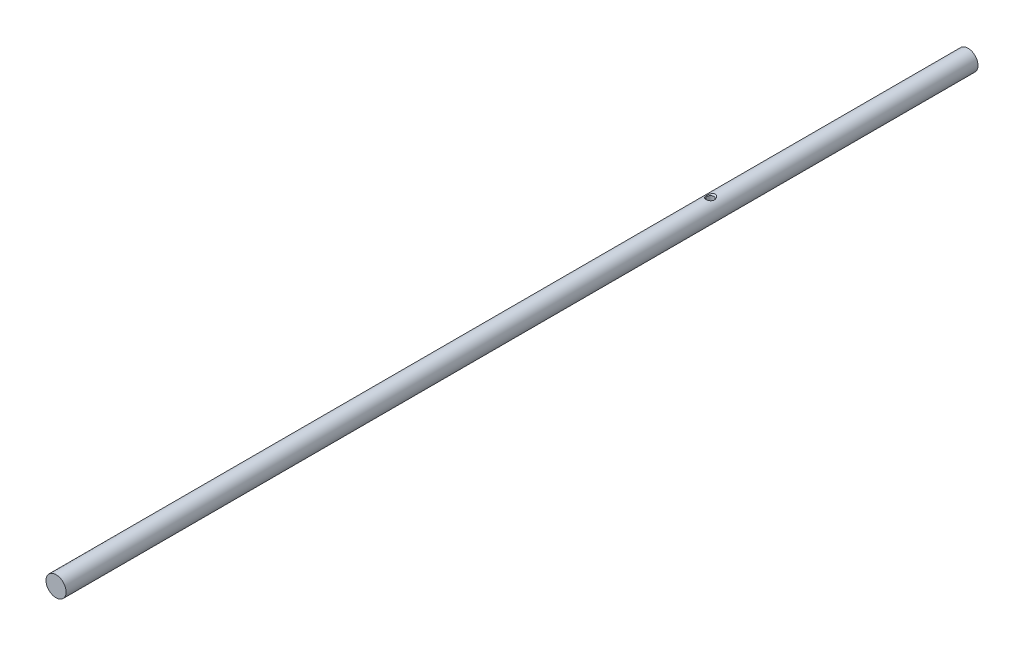
from build123d import *

# Parameters (mm, degrees)
SKETCH1_R           = 4.7625
BOSS_EXTRUDE1_DEPTH = 431.8


with BuildPart() as part:
    # Sketch1 → Boss-Extrude1 (new body)
    with BuildSketch(Plane.XY):
        Circle(SKETCH1_R)
    extrude(amount=BOSS_EXTRUDE1_DEPTH)

    # Sketch3 → 1/8 (0.125) Press Dowel Hole1 (revolve, cut)
    with BuildSketch(Plane(origin=(0, 4.7625, 121.92), x_dir=(0, 0, 1), z_dir=(1, 0, 0))):
        Polygon((0, 0), (0, 9.525), (1.5875, 9.525), (1.5875, 0.635), (2.2225, 0), align=None)
    revolve(axis=Axis((0, 11.1125, 121.92), (0, -1, 0)), mode=Mode.SUBTRACT)


solid = part.part
